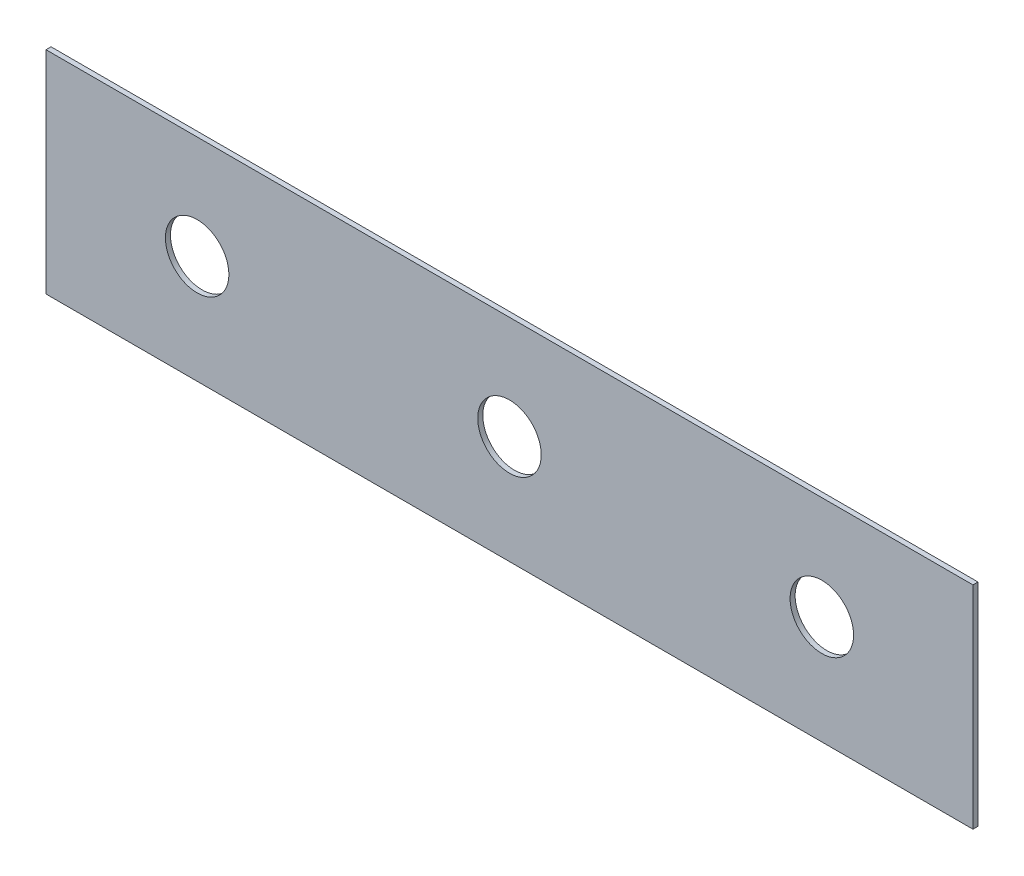
from build123d import *

# Parameters (mm, degrees)
THREE_12_6_MM_LOCATING_BORES_PROFILE_W = 184
THREE_12_6_MM_LOCATING_BORES_PROFILE_H = 42
THREE_12_6_MM_LOCATING_BORES_PROFILE_R = 6.3
THREE_12_6_MM_LOCATING_BORES_DEPTH     = 1


with BuildPart() as part:
    # Three 12.6 mm locating bores profile → Three 12.6 mm locating bores (new body)
    with BuildSketch(Plane.XY):
        with Locations((0, 28)):
            Rectangle(THREE_12_6_MM_LOCATING_BORES_PROFILE_W, THREE_12_6_MM_LOCATING_BORES_PROFILE_H)
        with Locations((-62, 28.5)):
            Circle(THREE_12_6_MM_LOCATING_BORES_PROFILE_R, mode=Mode.SUBTRACT)
        with Locations((0, 28.5)):
            Circle(THREE_12_6_MM_LOCATING_BORES_PROFILE_R, mode=Mode.SUBTRACT)
        with Locations((62, 28.5)):
            Circle(THREE_12_6_MM_LOCATING_BORES_PROFILE_R, mode=Mode.SUBTRACT)
    extrude(amount=THREE_12_6_MM_LOCATING_BORES_DEPTH)


solid = part.part
